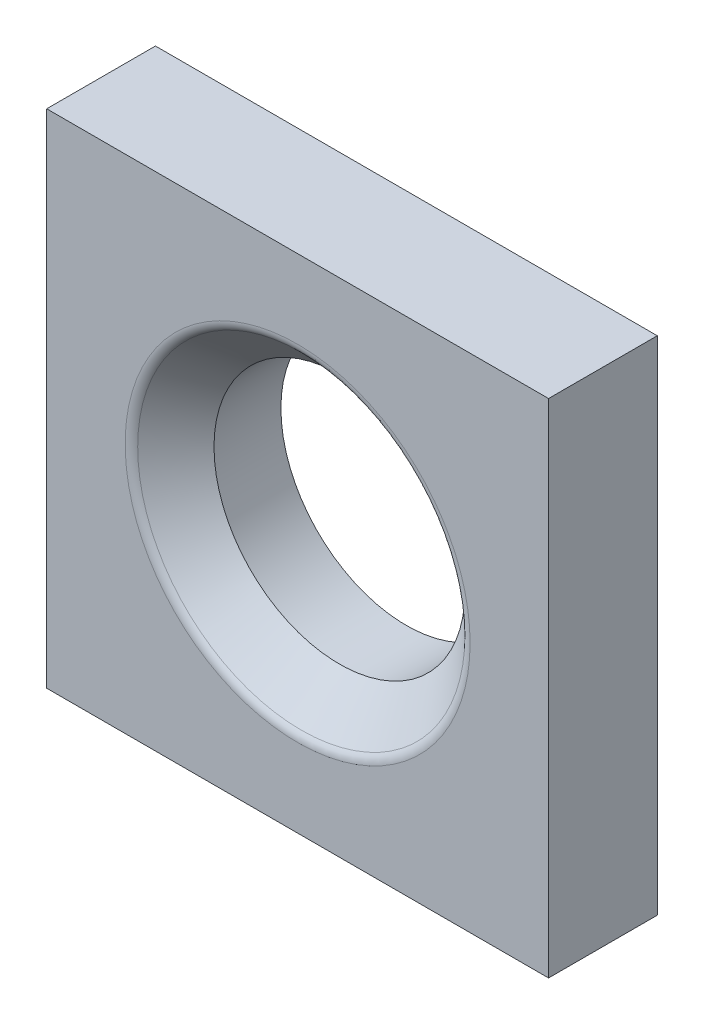
from build123d import *

# Parameters (mm, degrees)
SKETCH1_W           = 60
SKETCH1_H           = 60
SKETCH1_R           = 15
BOSS_EXTRUDE1_DEPTH = 13
CHAMFER1_SIZE       = 5
FILLET1_R           = 1.5


with BuildPart() as part:
    # Sketch1 → Boss-Extrude1 (new body)
    with BuildSketch(Plane.XY):
        Rectangle(SKETCH1_W, SKETCH1_H)
        with Locations(Location((0, 0, 0), (0, 0, 180))):
            Circle(SKETCH1_R, mode=Mode.SUBTRACT)
    extrude(amount=BOSS_EXTRUDE1_DEPTH)

    # Chamfer1
    chamfer1_edges = [part.edges().sort_by_distance(p)[0] for p in [
        (15, 0, 13),
    ]]
    chamfer(chamfer1_edges, length=CHAMFER1_SIZE)

    # Fillet1
    fillet1_edges = [part.edges().sort_by_distance(p)[0] for p in [
        (20, 0, 13),
    ]]
    fillet(fillet1_edges, radius=FILLET1_R)


solid = part.part
